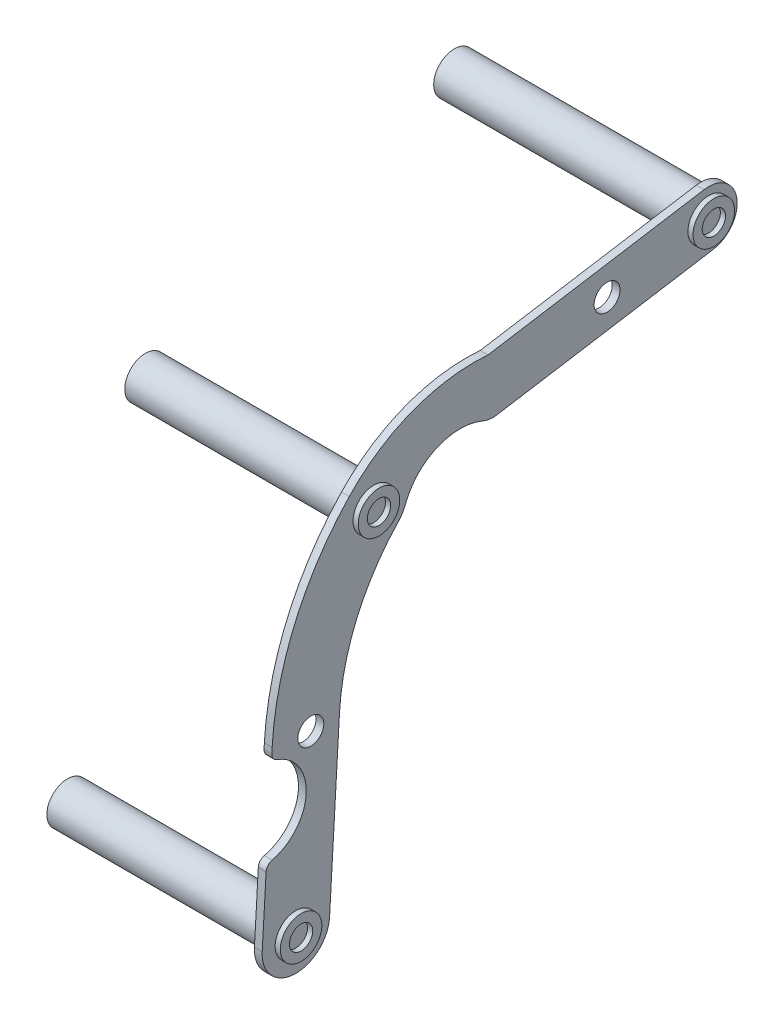
from build123d import *

# Parameters (mm, degrees)
SKETCH1_R                   = 8
MOUNT_TUBES_DEPTH           = 45
MOUNT_TUBES_2_DEPTH         = 45
MOUNT_TUBES_3_DEPTH         = 45
SKETCH2_R                   = 8
EXTEND_TUBE_1_DEPTH         = 10
MOUNT_TUBE_HOLES_DEPTH      = 243.629694853
MOUNT_TUBE_HOLES_DEPTH_BACK = 243.629694853
SKETCH3_R                   = 4.5
SIDE_PLATE_RH_DEPTH         = 3
MOTOR_MOUNT_HOLES_R         = 5
MOTOR_MOUNT_HOLES_F_DEPTH   = 247.763767871


with BuildPart() as part:
    # Sketch1 → mount tubes (new, symmetric)
    with BuildSketch(Plane(origin=(0, 0, 0), x_dir=(0, 0, -1), z_dir=(1, 0, 0))):
        with Locations(Location((0, 0, 0), (0, 0, 180))):
            Circle(SKETCH1_R)
    extrude(amount=MOUNT_TUBES_DEPTH, both=True)


with BuildPart() as body_2:
    # Sketch1 → mount tubes 2 (new, symmetric)
    with BuildSketch(Plane(origin=(0, 0, 0), x_dir=(0, 0, -1), z_dir=(1, 0, 0))):
        with Locations(Location((30.031235259, 126.997538987, 0), (0, 0, 180))):
            Circle(SKETCH1_R)
    extrude(amount=MOUNT_TUBES_2_DEPTH, both=True)


with BuildPart() as body_3:
    # Sketch1 → mount tubes 3 (new, symmetric)
    with BuildSketch(Plane(origin=(0, 0, 0), x_dir=(0, 0, -1), z_dir=(1, 0, 0))):
        with Locations(Location((159.099025767, 159.099025767, 0), (0, 0, 180))):
            Circle(SKETCH1_R)
    extrude(amount=MOUNT_TUBES_3_DEPTH, both=True)

    # Sketch2 → extend tube 1 (add)
    with BuildSketch(Plane.ZY.offset(45)):
        with Locations((-159.099025767, 159.099025767)):
            Circle(SKETCH2_R)
    extrude(amount=EXTEND_TUBE_1_DEPTH)


with BuildPart() as mount_tube_holes_tool:
    # Sketch3 → mount tube holes (new, two sides: drawn at the far end of the back side and taken through both)
    with BuildSketch(Plane(origin=(0, 0, 0), x_dir=(0, 0, -1), z_dir=(1, 0, 0)).offset(-MOUNT_TUBE_HOLES_DEPTH_BACK)):
        Circle(SKETCH3_R)
        with Locations((30.031235259, 126.997538987)):
            Circle(SKETCH3_R)
        with Locations((159.099025767, 159.099025767)):
            Circle(SKETCH3_R)
    extrude(amount=MOUNT_TUBE_HOLES_DEPTH + MOUNT_TUBE_HOLES_DEPTH_BACK)


with BuildPart() as part_1:
    add(part.part)

    # mount tube holes: cut by mount_tube_holes_tool
    add(mount_tube_holes_tool.part, mode=Mode.SUBTRACT)



with BuildPart() as body_2_1:
    add(body_2.part)

    # mount tube holes: cut by mount_tube_holes_tool
    add(mount_tube_holes_tool.part, mode=Mode.SUBTRACT)


with BuildPart() as body_3_1:
    add(body_3.part)

    # mount tube holes: cut by mount_tube_holes_tool
    add(mount_tube_holes_tool.part, mode=Mode.SUBTRACT)


with BuildPart() as part_2:
    add(part_1.part)

    add(body_2_1.part)  # Side plate RH merges body 2

    add(body_3_1.part)  # Side plate RH merges body 3
    # Sketch4 → Side plate RH (add)
    with BuildSketch(Plane(origin=(40, 0, 0), x_dir=(0, 0, -1), z_dir=(1, 0, 0))):
        with BuildLine():
            Line((12.978386159, -0.749328179), (16.807561824, 65.572107296))
            ThreePointArc((16.807561824, 65.572107296), (23.501336664, 93.821843391), (39.475404328, 118.064025087))
            ThreePointArc((39.475404328, 118.064025087), (41.072624736, 120.135489845), (42.222827025, 122.484769304))
            ThreePointArc((42.222827025, 122.484769304), (54.40469235, 135.330973688), (72.108350397, 135.388433283))
            ThreePointArc((72.108350397, 135.388433283), (74.814895184, 134.666747236), (77.615418999, 134.724034171))
            Line((77.615418999, 134.724034171), (160.862063178, 148.241231374))
            ThreePointArc((160.862063178, 148.241231374), (169.95682016, 160.862063178), (157.335988356, 169.95682016))
            Line((157.335988356, 169.95682016), (74.089344178, 156.439622958))
            ThreePointArc((74.089344178, 156.439622958), (45.006724073, 152.267651322), (20.587066191, 135.931052888))
            ThreePointArc((20.587066191, 135.931052888), (-0.368139217, 104.129516319), (-9.149210493, 67.070763654))
            Line((-9.149210493, 67.070763654), (-9.268320599, 65.007773101))
            ThreePointArc((-9.268320599, 65.007773101), (-8.774360407, 63.178125859), (-7.282312147, 62.009623531))
            ThreePointArc((-7.282312147, 62.009623531), (3.971735746, 45.020109305), (-9.16284655, 29.438712206))
            ThreePointArc((-9.16284655, 29.438712206), (-10.779462777, 28.449693665), (-11.480714014, 26.689053894))
            Line((-11.480714014, 26.689053894), (-12.978386159, 0.749328179))
            ThreePointArc((-12.978386159, 0.749328179), (-0.749328179, -12.978386159), (12.978386159, -0.749328179))
        make_face()
    extrude(amount=SIDE_PLATE_RH_DEPTH)

    # motor mount holes → motor mount holes f (cut, through all)
    with BuildSketch(Plane(origin=(0, 0, 0), x_dir=(0, 0, -1), z_dir=(1, 0, 0))):
        with Locations(Location((119.938657263, 152.740349945, 0), (0, 0, 180))):
            Circle(MOTOR_MOUNT_HOLES_R)
        with Locations(Location((5.756211189, 65, 0), (0, 0, 180))):
            Circle(MOTOR_MOUNT_HOLES_R)
    extrude(amount=MOTOR_MOUNT_HOLES_F_DEPTH, mode=Mode.SUBTRACT)


solid = part_2.part
